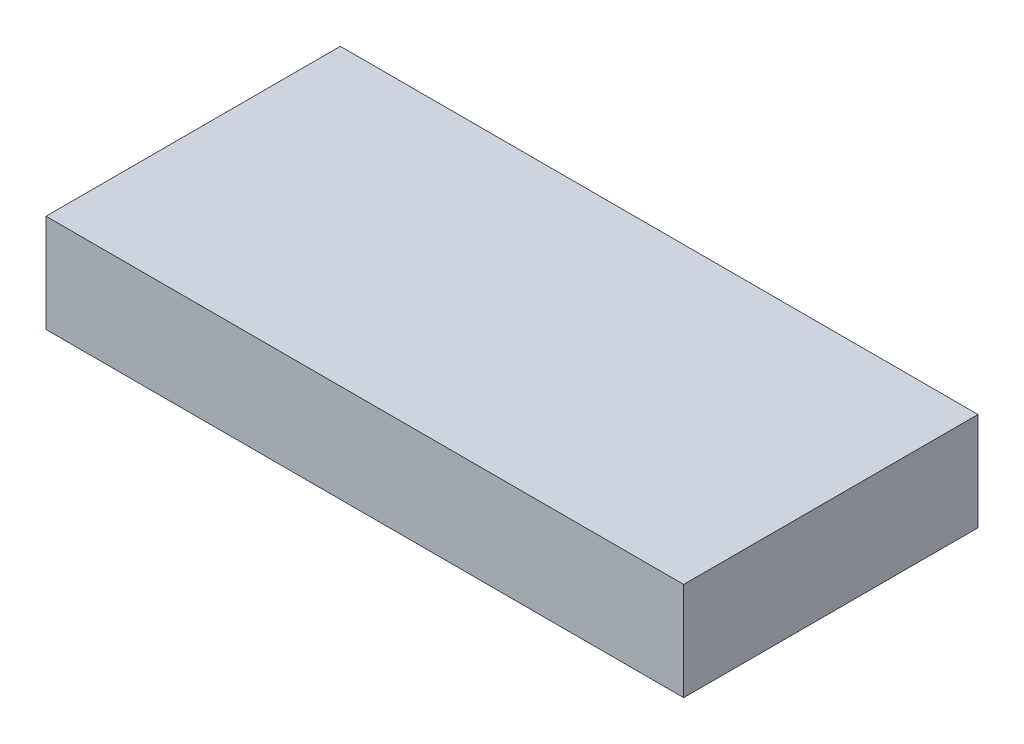
from build123d import *

# Parameters (mm, degrees)
SKETCH1_W           = 13
SKETCH1_H           = 6
BOSS_EXTRUDE1_DEPTH = 2


with BuildPart() as part:
    # Sketch1 → Boss-Extrude1 (new body)
    with BuildSketch(Plane(origin=(0, 0, 0), x_dir=(1, 0, 0), z_dir=(0, 1, 0))):
        Rectangle(SKETCH1_W, SKETCH1_H)
    extrude(amount=BOSS_EXTRUDE1_DEPTH)


solid = part.part
